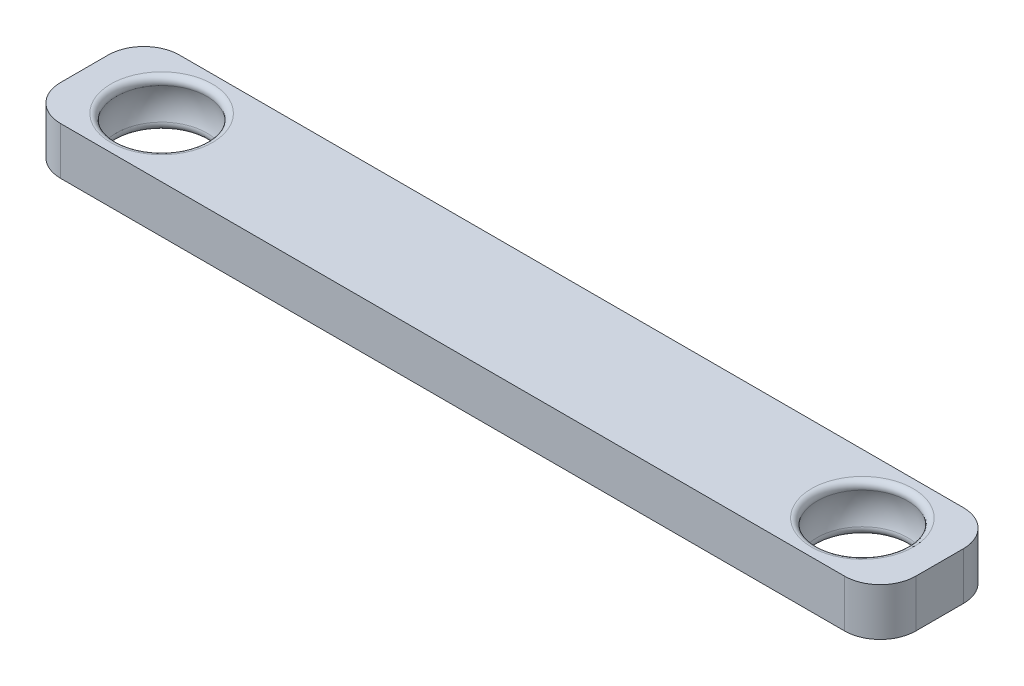
from build123d import *

# Parameters (mm, degrees)
SKETCH1_W           = 72
SKETCH1_H           = 10
BOSS_EXTRUDE1_DEPTH = 4
FILLET1_R           = 3
FILLET2_R           = 0.5


with BuildPart() as part:
    # Sketch1 → Boss-Extrude1 (new body)
    with BuildSketch(Plane(origin=(0, 0, 0), x_dir=(1, 0, 0), z_dir=(0, 1, 0))):
        Rectangle(SKETCH1_W, SKETCH1_H)
    extrude(amount=BOSS_EXTRUDE1_DEPTH)

    # Sketch2 → Cut-Revolve2 (revolve, cut)
    with BuildSketch(Plane.XY):
        with BuildLine():
            Line((-29.5, 4), (-29.5, 0))
            Line((-29.5, 0), (-33, 0))
            ThreePointArc((-33, 0), (-33.531128874, 2), (-33, 4))
            Line((-33, 4), (-29.5, 4))
        make_face()
    cut_revolve2 = revolve(axis=Axis((-29.5, 4, 0), (0, -1, 0)), mode=Mode.SUBTRACT)

    # Fillet1
    fillet1_edges = [part.edges().sort_by_distance(p)[0] for p in [
        (36, 2, 5),
        (-36, 2, 5),
        (-36, 2, -5),
        (36, 2, -5),
    ]]
    fillet(fillet1_edges, radius=FILLET1_R)

    # Mirror1: Cut-Revolve2 across plane
    add(cut_revolve2.mirror(Plane(origin=(0, 0, 0), x_dir=(0, 0, 1), z_dir=(1, 0, 0))), mode=Mode.SUBTRACT)

    # Fillet2
    fillet2_edges = [part.edges().sort_by_distance(p)[0] for p in [
        (-26, 4, 0),
        (-26, 0, 0),
        (26, 4, 0),
        (26, 0, 0),
    ]]
    fillet(fillet2_edges, radius=FILLET2_R)


solid = part.part
